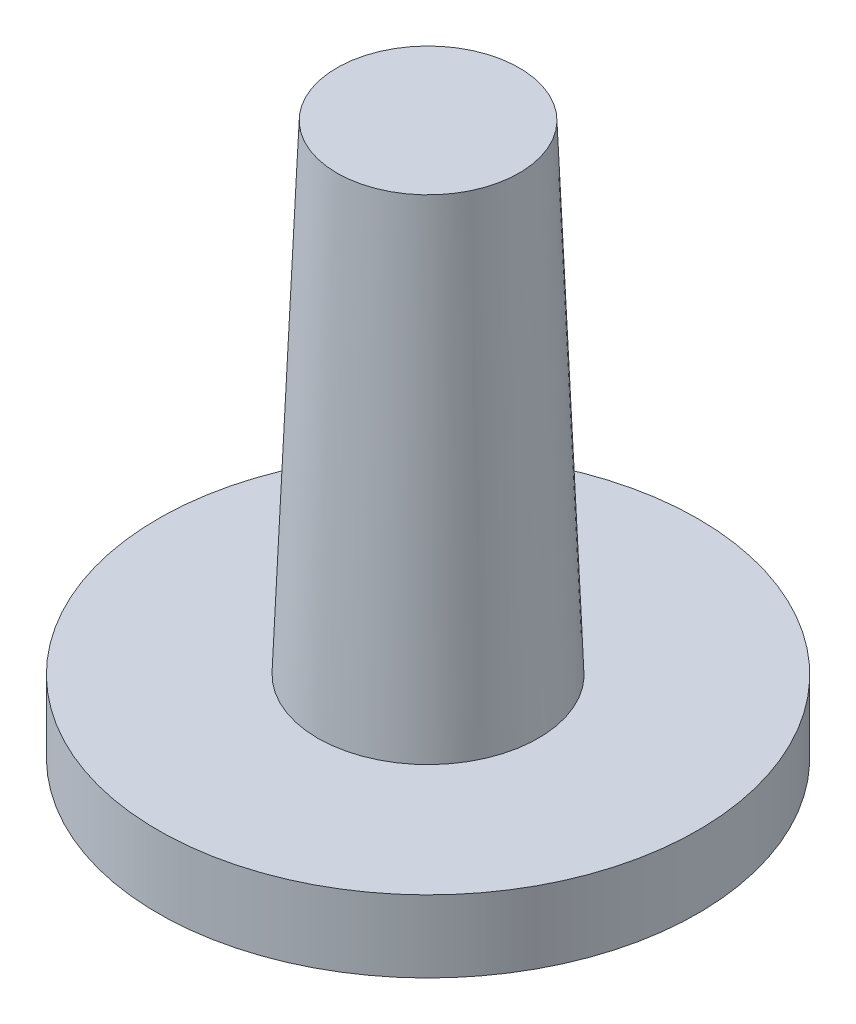
from build123d import *

# Parameters (mm, degrees)
SKETCH1_R           = 3.571875
BOSS_EXTRUDE1_DEPTH = 0.9525
SKETCH2_R           = 1.4605
BOSS_EXTRUDE2_DEPTH = 6.35


with BuildPart() as part:
    # Sketch1 → Boss-Extrude1 (new body)
    with BuildSketch(Plane(origin=(0, 0, 0), x_dir=(1, 0, 0), z_dir=(0, 1, 0))):
        with Locations(Location((0, 0, 0), (0, 0, 90))):
            Circle(SKETCH1_R)
    extrude(amount=BOSS_EXTRUDE1_DEPTH)

    # Sketch2 → Boss-Extrude2 (add)
    with BuildSketch(Plane(origin=(0, 0.9525, 0), x_dir=(1, 0, 0), z_dir=(0, 1, 0))):
        with Locations(Location((0, 0, 0), (0, 0, 270))):
            Circle(SKETCH2_R)
    extrude(amount=BOSS_EXTRUDE2_DEPTH)

    # Sketch3 → Cut-Revolve1 (revolve, cut)
    with BuildSketch(Plane(origin=(0, 0, 0), x_dir=(0, 0, -1), z_dir=(1, 0, 0))):
        Polygon((-1.4605, 0.9525), (-1.2065, 7.3025), (-1.4605, 7.3025), (-1.738282531, 7.3025), align=None)
    revolve(axis=Axis((0, 7.3025, 0), (0, -1, 0)), mode=Mode.SUBTRACT)


solid = part.part
